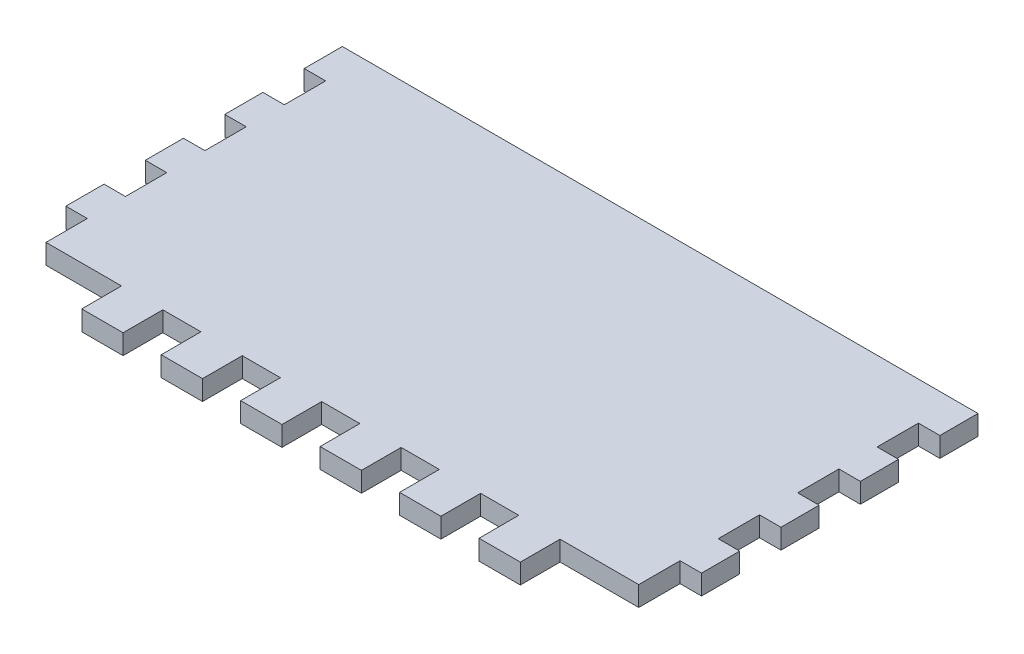
from build123d import *

# Parameters (mm, degrees)
SKETCH1_W               = 101.6
SKETCH1_H               = 107.95
BOSS_EXTRUDE1_DEPTH     = 3.175
CUT_EXTRUDE1_DEPTH      = 75.189091179
CUT_EXTRUDE1_DEPTH_BACK = 75.189091179
SKETCH2_W               = 3.429
SKETCH2_H               = 6.604
SKETCH3_W               = 101.6
SKETCH3_H               = 50.8
CUT_EXTRUDE2_DEPTH      = 75.189091179


with BuildPart() as part:
    # Sketch1 → Boss-Extrude1 (new body)
    with BuildSketch(Plane(origin=(0, 0, 0), x_dir=(1, 0, 0), z_dir=(0, 1, 0))):
        Rectangle(SKETCH1_W, SKETCH1_H)
    extrude(amount=BOSS_EXTRUDE1_DEPTH)

    # Sketch2 → Cut-Extrude1 (cut, two sides: drawn at the far end of the back side and taken through both)
    with BuildSketch(Plane(origin=(0, 3.175, 0), x_dir=(1, 0, 0), z_dir=(0, 1, 0)).offset(-CUT_EXTRUDE1_DEPTH_BACK)):
        Polygon((22.098, -47.625), (28.194, -47.625), (28.194, -54.229), (34.798, -54.229), (34.798, -47.625), (47.371, -47.625), (47.371, -41.021), (50.8, -41.021), (50.8, -47.625), (50.8, -92.544961432), (-50.8, -92.544961432), (-50.8, -47.625), (-50.8, -41.021), (-47.371, -41.021), (-47.371, -47.625), (-35.306, -47.625), (-35.306, -54.229), (-28.702, -54.229), (-28.702, -47.625), (-22.606, -47.625), (-22.606, -54.229), (-16.002, -54.229), (-16.002, -47.625), (-9.906, -47.625), (-9.906, -54.229), (-3.302, -54.229), (-3.302, -47.625), (2.794, -47.625), (2.794, -54.229), (9.398, -54.229), (9.398, -47.625), (15.494, -47.625), (15.494, -54.229), (22.098, -54.229), align=None)
        with Locations((-49.0855, 31.75)):
            Rectangle(SKETCH2_W, SKETCH2_H)
        with Locations((-49.0855, 19.177)):
            Rectangle(SKETCH2_W, SKETCH2_H)
        with Locations((-49.0855, 6.477)):
            Rectangle(SKETCH2_W, SKETCH2_H)
        with Locations((-49.0855, -6.223)):
            Rectangle(SKETCH2_W, SKETCH2_H)
        with Locations((-49.0855, -18.923)):
            Rectangle(SKETCH2_W, SKETCH2_H)
        with Locations((-49.0855, -31.623)):
            Rectangle(SKETCH2_W, SKETCH2_H)
        with Locations((49.0855, -31.623)):
            Rectangle(SKETCH2_W, SKETCH2_H)
        with Locations((49.0855, -18.923)):
            Rectangle(SKETCH2_W, SKETCH2_H)
        with Locations((49.0855, -6.223)):
            Rectangle(SKETCH2_W, SKETCH2_H)
        with Locations((49.0855, 6.477)):
            Rectangle(SKETCH2_W, SKETCH2_H)
        with Locations((49.0855, 19.177)):
            Rectangle(SKETCH2_W, SKETCH2_H)
        with Locations((49.0855, 31.75)):
            Rectangle(SKETCH2_W, SKETCH2_H)
        with Locations((49.0855, 44.45)):
            Rectangle(SKETCH2_W, SKETCH2_H)
        with Locations((-49.0855, 44.45)):
            Rectangle(SKETCH2_W, SKETCH2_H)
    extrude(amount=CUT_EXTRUDE1_DEPTH + CUT_EXTRUDE1_DEPTH_BACK, mode=Mode.SUBTRACT)

    # Sketch3 → Cut-Extrude2 (cut, through all)
    with BuildSketch(Plane(origin=(0, 3.175, 0), x_dir=(1, 0, 0), z_dir=(0, 1, 0))):
        with Locations((0, 28.575)):
            Rectangle(SKETCH3_W, SKETCH3_H)
    extrude(amount=-CUT_EXTRUDE2_DEPTH, mode=Mode.SUBTRACT)


solid = part.part
